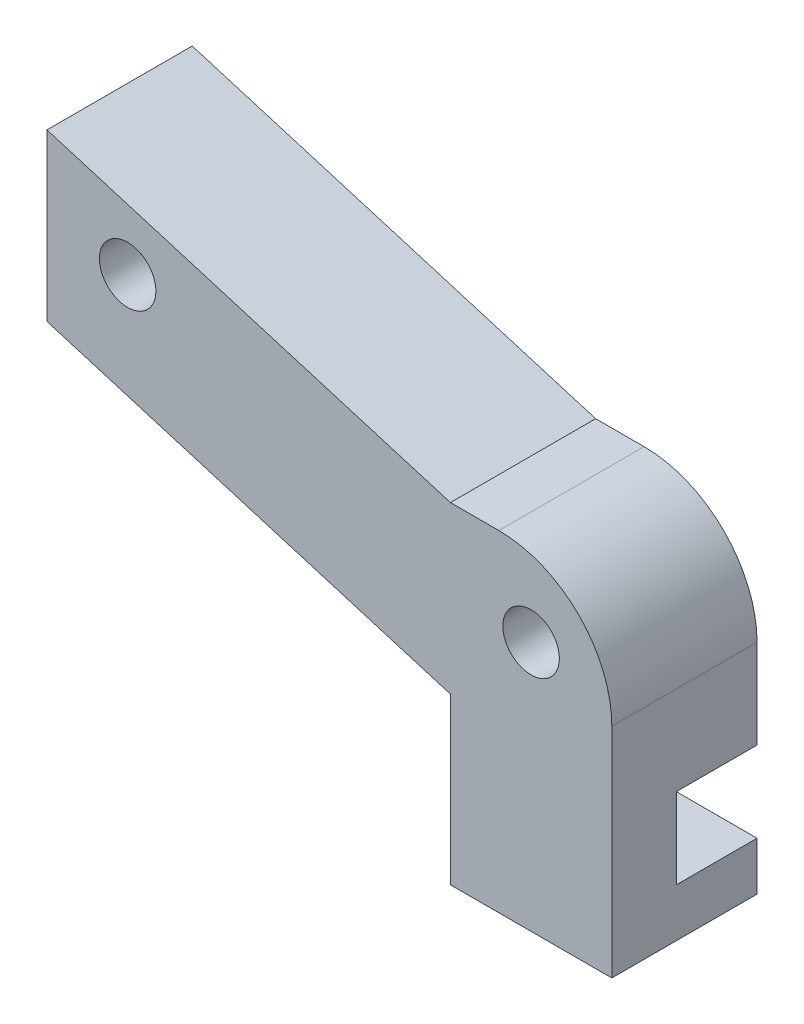
from build123d import *

# Parameters (mm, degrees)
BOSS_EXTRUDE1_DEPTH = 9
SKETCH3_R           = 1.75
CUT_EXTRUDE1_DEPTH  = 9
SKETCH5_R           = 1.5
CUT_EXTRUDE2_DEPTH  = 10
SKETCH6_W           = 5
SKETCH6_H           = 5
CUT_EXTRUDE3_DEPTH  = 10
FILLET1_R           = 7


with BuildPart() as part:
    # Sketch2 → Boss-Extrude1 (new body)
    with BuildSketch(Plane.XY):
        Polygon((-15.81579683, -97.193157961), (-15.81579683, -107.474376779), (9.18420317, -114.974376779), (9.18420317, -125.206503808), (19.18420317, -125.206503808), (19.18420317, -114.974376779), (19.18420317, -104.693157961), (9.18420317, -104.693157961), align=None)
    extrude(amount=BOSS_EXTRUDE1_DEPTH)

    # Sketch3 → Cut-Extrude1 (cut)
    with BuildSketch(Plane.XY.offset(9)):
        with Locations((14.18420317, -109.693157961)):
            Circle(SKETCH3_R)
        with Locations((-10.81579683, -102.474376779)):
            Circle(SKETCH3_R)
    extrude(amount=-CUT_EXTRUDE1_DEPTH, mode=Mode.SUBTRACT)

    # Sketch5 → Cut-Extrude2 (cut)
    with BuildSketch(Plane.XZ.offset(125.206503808)):
        with Locations(Location((14.18420317, 3, 0), (0, 0, 270))):
            Circle(SKETCH5_R)
    extrude(amount=-CUT_EXTRUDE2_DEPTH, mode=Mode.SUBTRACT)

    # Sketch6 → Cut-Extrude3 (cut)
    with BuildSketch(Plane(origin=(19.18420317, 0, 0), x_dir=(0, 0, -1), z_dir=(1, 0, 0))):
        with Locations((-2.5, -119.706503808)):
            Rectangle(SKETCH6_W, SKETCH6_H)
    extrude(amount=-CUT_EXTRUDE3_DEPTH, mode=Mode.SUBTRACT)

    # Fillet1
    fillet1_edges = [part.edges().sort_by_distance(p)[0] for p in [
        (19.18420317, -104.693157961, 4.5),
    ]]
    fillet(fillet1_edges, radius=FILLET1_R)


solid = part.part
